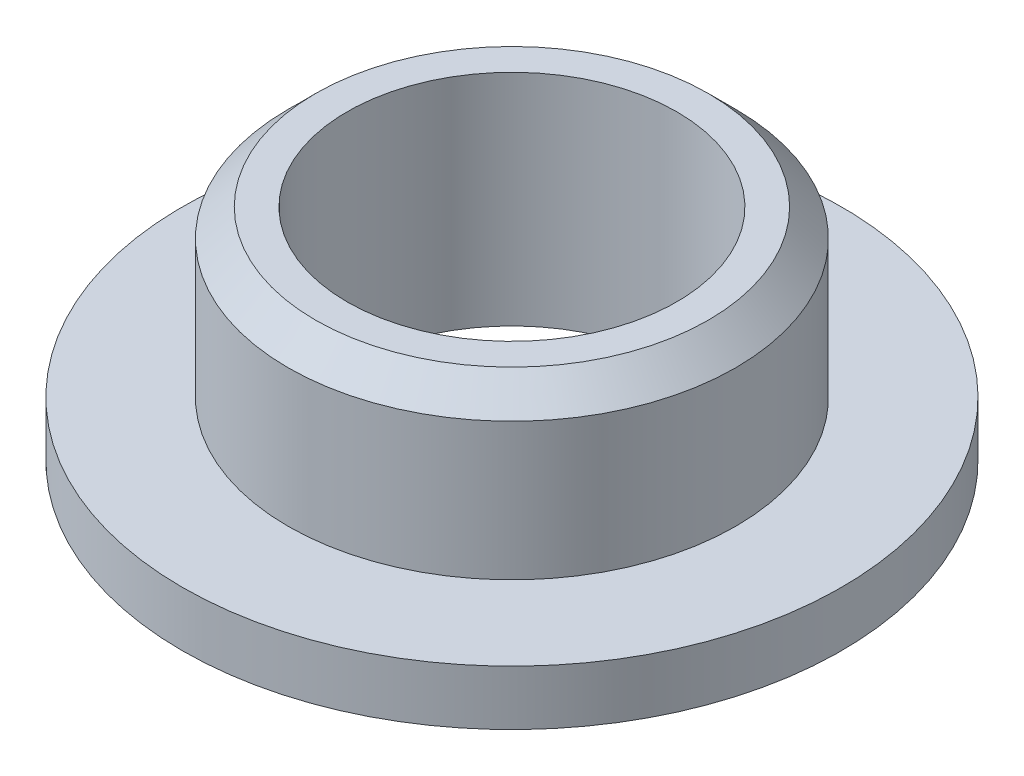
from build123d import *

# Parameters (mm, degrees)
SKETCH_1_R          = 6
EXTRUDE_1_DEPTH     = 1
SKETCH_2_R          = 4.075
SKETCH_2_R_2        = 3
EXTRUDE_2_DEPTH     = 3
CUT_EXTRUDE_START   = -3
SKETCH_3_R          = 3
CUT_EXTRUDE_1_DEPTH = 3
CHAMFER_1_SIZE      = 0.5


with BuildPart() as part:
    # 草图1 → 凸台-拉伸1 (new body)
    with BuildSketch(Plane(origin=(0, 0, 0), x_dir=(1, 0, 0), z_dir=(0, 1, 0))):
        with Locations(Location((-0.138701754, 0.180249091, 0), (0, 0, 270))):
            Circle(SKETCH_1_R)
    extrude(amount=EXTRUDE_1_DEPTH)

    # 草图2 → 凸台-拉伸2 (add)
    with BuildSketch(Plane(origin=(0, 1, 0), x_dir=(1, 0, 0), z_dir=(0, 1, 0))):
        with Locations(Location((-0.138701754, 0.180249091, 0), (0, 0, 270))):
            Circle(SKETCH_2_R)
        with Locations(Location((-0.138701754, 0.180249091, 0), (0, 0, 270))):
            Circle(SKETCH_2_R_2, mode=Mode.SUBTRACT)
    extrude(amount=EXTRUDE_2_DEPTH)

    # 草图3 → 切除-拉伸1 (cut)
    with BuildSketch(Plane(origin=(0, 1, 0), x_dir=(1, 0, 0), z_dir=(0, 1, 0)).offset(CUT_EXTRUDE_START)):
        with Locations(Location((-0.138701754, 0.180249091, 0), (0, 0, 270))):
            Circle(SKETCH_3_R)
    extrude(amount=CUT_EXTRUDE_1_DEPTH, mode=Mode.SUBTRACT)

    # 倒角1
    chamfer_1_edges = [part.edges().sort_by_distance(p)[0] for p in [
        (-0.138701754, 4, -4.255249091),
    ]]
    chamfer(chamfer_1_edges, length=CHAMFER_1_SIZE)


solid = part.part
